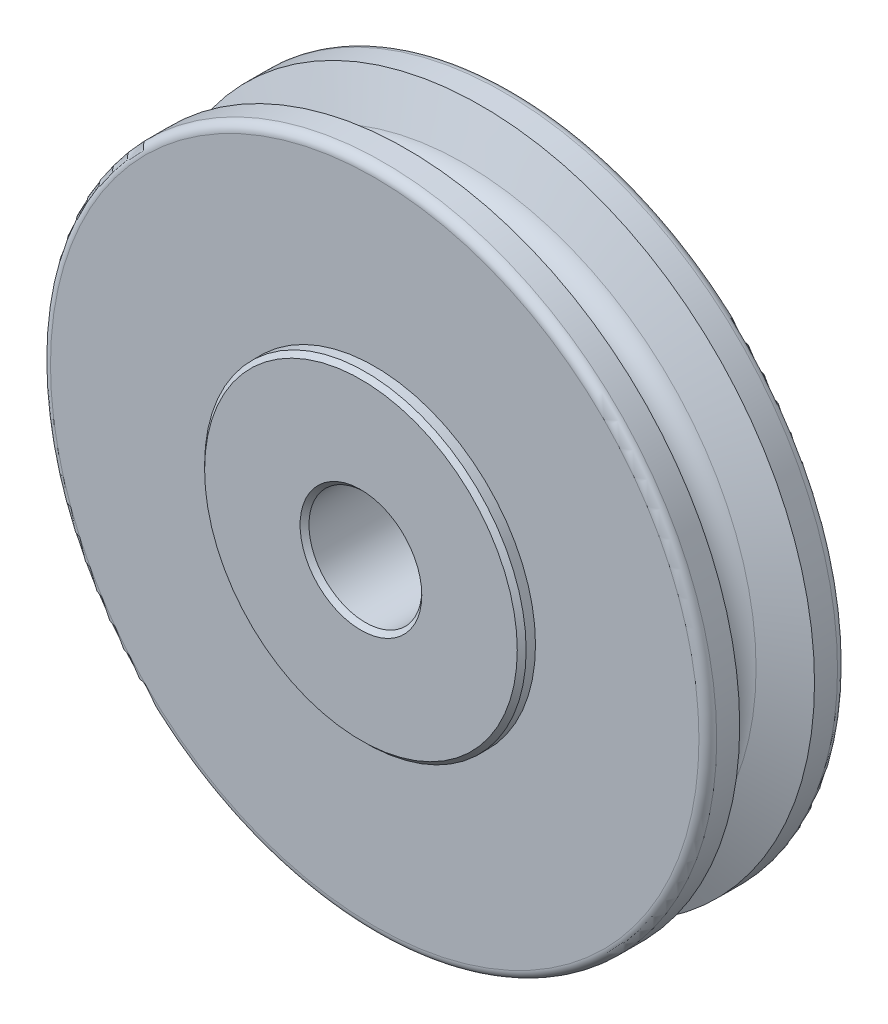
from build123d import *


with BuildPart() as part:
    # Sketch2 → Bushing Revolve (revolve)
    with BuildSketch(Plane(origin=(0, 0, 0), x_dir=(0, 0, -1), z_dir=(1, 0, 0)), mode=Mode.PRIVATE) as bushing_revolve_sk:
        Polygon((-2.3749, 4.4704), (-2.3749, 1.7399), (-2.2479, 1.6129), (2.2479, 1.6129), (2.3749, 1.7399), (2.3749, 4.4704), (2.2479, 4.5974), (-2.2479, 4.5974), align=None)
    revolve(bushing_revolve_sk.sketch.rotate(Axis((0, 0, 2.3749), (0, 0, -1)), 90), axis=Axis((0, 0, 2.3749), (0, 0, -1)))


with BuildPart() as body_2:
    # Sketch3 → Sheave Revolve (revolve)
    with BuildSketch(Plane(origin=(0, 0, 0), x_dir=(0, 0, -1), z_dir=(1, 0, 0)), mode=Mode.PRIVATE) as sheave_revolve_sk:
        with BuildLine():
            Line((1.9812, 4.5974), (-1.9812, 4.5974))
            Line((-1.9812, 4.5974), (-1.9812, 9.271))
            ThreePointArc((-1.9812, 9.271), (-1.906805122, 9.450605122), (-1.7272, 9.525))
            Line((-1.7272, 9.525), (-1.069704542, 9.525))
            Line((-1.069704542, 9.525), (-0.588761748, 8.334624813))
            ThreePointArc((-0.588761748, 8.334624813), (0, 7.9375), (0.588761748, 8.334624813))
            Line((0.588761748, 8.334624813), (1.069704542, 9.525))
            Line((1.069704542, 9.525), (1.7272, 9.525))
            ThreePointArc((1.7272, 9.525), (1.906805122, 9.450605122), (1.9812, 9.271))
            Line((1.9812, 9.271), (1.9812, 4.5974))
        make_face()
    revolve(sheave_revolve_sk.sketch.rotate(Axis((0, 0, 2.3749), (0, 0, -1)), 90), axis=Axis((0, 0, 2.3749), (0, 0, -1)))


solid = Compound([part.part, body_2.part])
